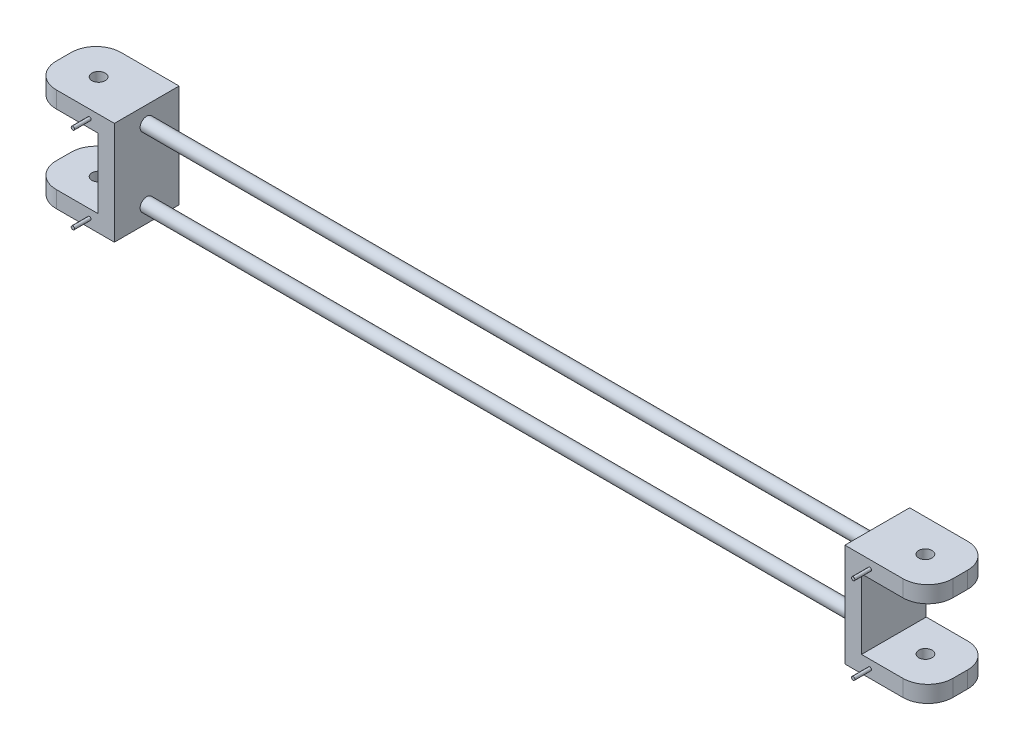
from build123d import *

# Parameters (mm, degrees)
ESQUISSE1_W                  = 540
ESQUISSE1_H                  = 39
BOSS_EXTRU_1_DEPTH           = 10
CONG_1_R                     = 15
ESQUISSE3_W                  = 10
ESQUISSE3_H                  = 39
BOSS_EXTRU_2_DEPTH           = 42
ESQUISSE4_W                  = 540
ESQUISSE4_H                  = 39
BOSS_EXTRU_3_DEPTH           = 10
CONG_2_R                     = 15
ENL_V_MAT_EXTRU_2_DEPTH      = 278.712531226
ENL_V_MAT_EXTRU_2_DEPTH_BACK = 278.712531226
ESQUISSE5_R                  = 4
ESQUISSE6_R                  = 1
BOSS_EXTRU_4_DEPTH           = 10
ENL_V_MAT_EXTRU_3_DEPTH      = 280.758824704
ENL_V_MAT_EXTRU_3_DEPTH_BACK = 280.758824704
ESQUISSE7_W                  = 440
ESQUISSE7_H                  = 10
ENL_V_MAT_EXTRU_4_DEPTH      = 277.53978014
ENL_V_MAT_EXTRU_4_DEPTH_BACK = 277.53978014
ESQUISSE13_W                 = 440
ESQUISSE13_H                 = 39
BOSS_EXTRU_6_REACH           = 496.787
ESQUISSE14_R                 = 4


with BuildPart() as part:
    # Esquisse1 → Boss.-Extru.1 (new body)
    with BuildSketch(Plane(origin=(0, 0, 0), x_dir=(1, 0, 0), z_dir=(0, 1, 0))):
        Rectangle(ESQUISSE1_W, ESQUISSE1_H)
    extrude(amount=BOSS_EXTRU_1_DEPTH)

    # Congé1
    cong_1_edges = [part.edges().sort_by_distance(p)[0] for p in [
        (270, 5, 19.5),
        (-270, 5, 19.5),
        (-270, 5, -19.5),
        (270, 5, -19.5),
    ]]
    fillet(cong_1_edges, radius=CONG_1_R)

    # Esquisse3 → Boss.-Extru.2 (add)
    with BuildSketch(Plane(origin=(0, 10, 0), x_dir=(1, 0, 0), z_dir=(0, 1, 0))):
        with Locations((-225, 0)):
            Rectangle(ESQUISSE3_W, ESQUISSE3_H)
        with Locations((225, 0)):
            Rectangle(ESQUISSE3_W, ESQUISSE3_H)
    extrude(amount=BOSS_EXTRU_2_DEPTH)

    # Esquisse4 → Boss.-Extru.3 (add)
    with BuildSketch(Plane(origin=(0, 52, 0), x_dir=(1, 0, 0), z_dir=(0, 1, 0))):
        Rectangle(ESQUISSE4_W, ESQUISSE4_H)
    extrude(amount=BOSS_EXTRU_3_DEPTH)

    # Congé2
    cong_2_edges = [part.edges().sort_by_distance(p)[0] for p in [
        (-270, 57, -19.5),
        (-270, 57, 19.5),
        (270, 57, 19.5),
        (270, 57, -19.5),
    ]]
    fillet(cong_2_edges, radius=CONG_2_R)

    # Esquisse5 → Enlèv. mat.-Extru.2 (cut, two sides: drawn at the far end of the back side and taken through both)
    with BuildSketch(Plane(origin=(0, 62, 0), x_dir=(1, 0, 0), z_dir=(0, 1, 0)).offset(-ENL_V_MAT_EXTRU_2_DEPTH_BACK)):
        with Locations(Location((249, 0, 0), (0, 0, 270))):
            Circle(ESQUISSE5_R)
        with Locations(Location((-249, 0, 0), (0, 0, 270))):
            Circle(ESQUISSE5_R)
    extrude(amount=ENL_V_MAT_EXTRU_2_DEPTH + ENL_V_MAT_EXTRU_2_DEPTH_BACK, mode=Mode.SUBTRACT)

    # Esquisse6 → Boss.-Extru.4 (add)
    with BuildSketch(Plane.XY.offset(19.5)):
        with Locations(Location((-235, 57, 0), (0, 0, 180))):
            Circle(ESQUISSE6_R)
        with Locations(Location((-235, 5, 0), (0, 0, 180))):
            Circle(ESQUISSE6_R)
        with Locations(Location((235, 5, 0), (0, 0, 180))):
            Circle(ESQUISSE6_R)
        with Locations(Location((235, 57, 0), (0, 0, 180))):
            Circle(ESQUISSE6_R)
    extrude(amount=BOSS_EXTRU_4_DEPTH)

    # Esquisse7 → Enlèv. mat.-Extru.3 (cut, two sides: drawn at the far end of the back side and taken through both)
    with BuildSketch(Plane.XY.offset(19.5).offset(-ENL_V_MAT_EXTRU_3_DEPTH_BACK)):
        with Locations((0, 57)):
            Rectangle(ESQUISSE7_W, ESQUISSE7_H)
    extrude(amount=ENL_V_MAT_EXTRU_3_DEPTH + ENL_V_MAT_EXTRU_3_DEPTH_BACK, mode=Mode.SUBTRACT)

    # Esquisse13 → Enlèv. mat.-Extru.4 (cut, two sides: drawn at the far end of the back side and taken through both)
    with BuildSketch(Plane(origin=(0, 10, 0), x_dir=(1, 0, 0), z_dir=(0, 1, 0)).offset(-ENL_V_MAT_EXTRU_4_DEPTH_BACK)):
        Rectangle(ESQUISSE13_W, ESQUISSE13_H)
    extrude(amount=ENL_V_MAT_EXTRU_4_DEPTH + ENL_V_MAT_EXTRU_4_DEPTH_BACK, mode=Mode.SUBTRACT)


with BuildPart() as enl_v_mat_extru_4_piece_1:
    # of the separate pieces the step leaves, piece 1, a body of its own (enl_v_mat_extru_4_pieces)
    add(part.part.solids().sort_by_distance((220, 0, -19.5))[0])

    # Esquisse14 → Boss.-Extru.6 (add, up to next)
    with BuildSketch(Plane(origin=(-220, 0, 0), x_dir=(0, 0, -1), z_dir=(1, 0, 0)), mode=Mode.PRIVATE) as boss_extru_6_sk1:
        with Locations((0, 52)):
            Circle(ESQUISSE14_R)
    boss_extru_6_tool1 = extrude(boss_extru_6_sk1.sketch, amount=BOSS_EXTRU_6_REACH, mode=Mode.PRIVATE) - enl_v_mat_extru_4_piece_1.part
    # Esquisse14 → Boss.-Extru.6 (add, up to next)
    with BuildSketch(Plane(origin=(-220, 0, 0), x_dir=(0, 0, -1), z_dir=(1, 0, 0)), mode=Mode.PRIVATE) as boss_extru_6_sk2:
        with Locations(Location((0, 10, 0), (0, 0, 180))):
            Circle(ESQUISSE14_R)
    boss_extru_6_tool2 = extrude(boss_extru_6_sk2.sketch, amount=BOSS_EXTRU_6_REACH, mode=Mode.PRIVATE) - enl_v_mat_extru_4_piece_1.part


with BuildPart() as enl_v_mat_extru_4_piece_2:
    # of the separate pieces the step leaves, piece 2, a body of its own (enl_v_mat_extru_4_pieces)
    add(part.part.solids().sort_by_distance((-255, 52, -19.5))[0])


with BuildPart() as enl_v_mat_extru_4_piece_1_1:
    add(enl_v_mat_extru_4_piece_1.part)

    add(enl_v_mat_extru_4_piece_2.part)  # Boss.-Extru.6 merges Enlèv. mat.-Extru.4 piece 2
    add(boss_extru_6_tool1.solids().sort_by_distance((-220, 52, 0))[0])
    add(boss_extru_6_tool2.solids().sort_by_distance((-220, 10, 0))[0])


solid = enl_v_mat_extru_4_piece_1_1.part
